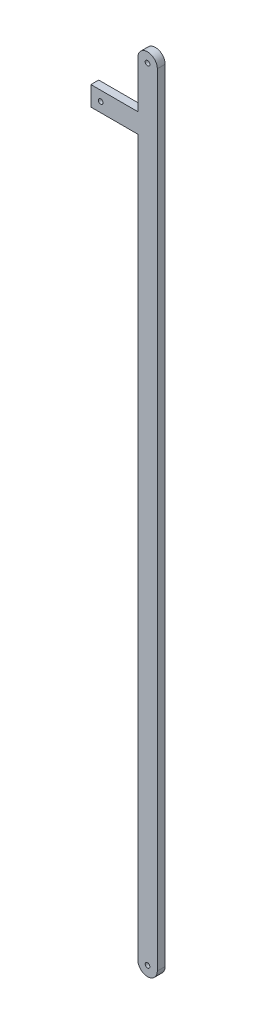
from build123d import *

# Parameters (mm, degrees)
SKETCH1_R           = 3
BOSS_EXTRUDE1_DEPTH = 10


with BuildPart() as part:
    # Sketch1 → Boss-Extrude1 (new body)
    with BuildSketch(Plane.XY):
        with BuildLine():
            Line((-12.5, 0), (-12.5, -60))
            Line((-12.5, -60), (-72.5, -60))
            Line((-72.5, -60), (-72.5, -85))
            Line((-72.5, -85), (-12.5, -85))
            Line((-12.5, -85), (-12.5, -1000))
            ThreePointArc((-12.5, -1000), (0, -1012.5), (12.5, -1000))
            Line((12.5, -1000), (12.5, 0))
            ThreePointArc((12.5, 0), (0, 12.5), (-12.5, 0))
        make_face()
        Circle(SKETCH1_R, mode=Mode.SUBTRACT)
        with Locations(Location((0, -1000, 0), (0, 0, 180))):
            Circle(SKETCH1_R, mode=Mode.SUBTRACT)
        with Locations((-60, -72.5)):
            Circle(SKETCH1_R, mode=Mode.SUBTRACT)
    extrude(amount=BOSS_EXTRUDE1_DEPTH)


solid = part.part
